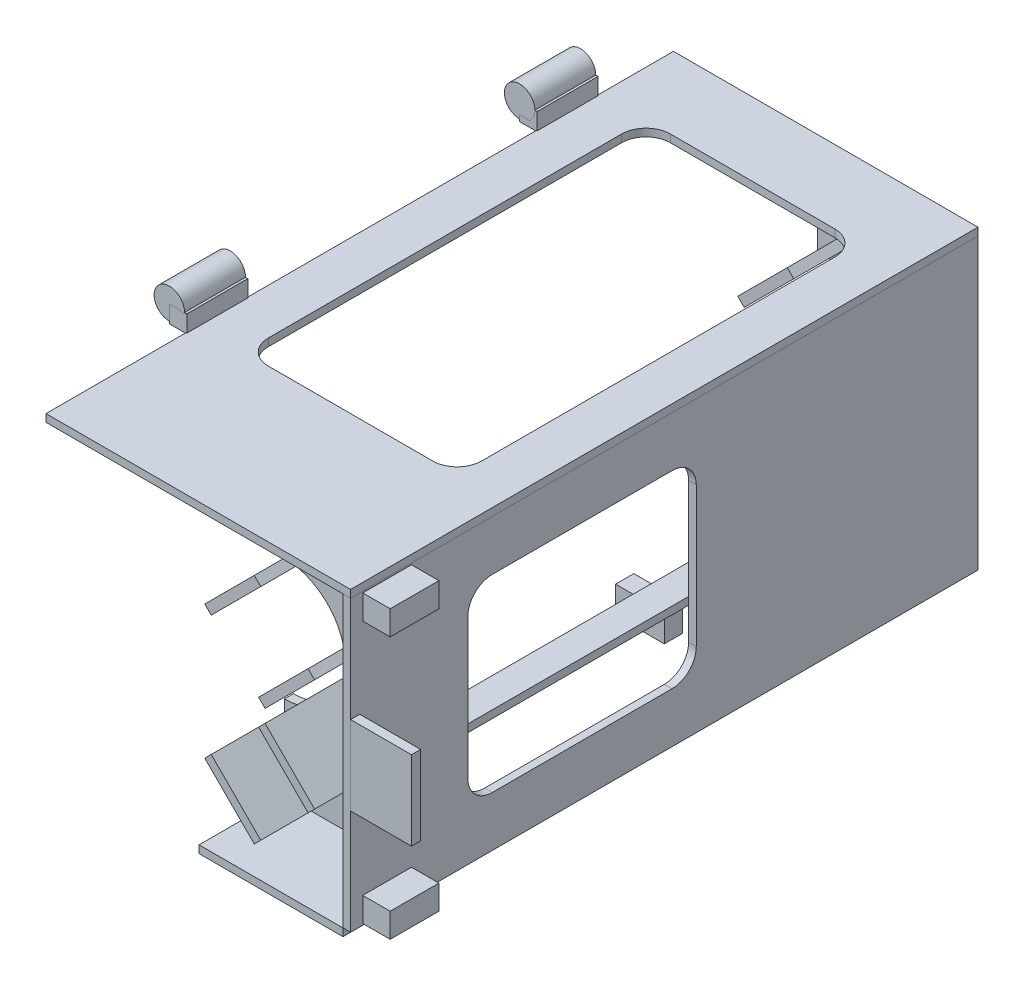
from build123d import *

# Parameters (mm, degrees)
EXTRUDE_START       = 180
EXTRUDE_1_DEPTH     = 6
EXTRUDE_START_2     = 186
EXTRUDE_2_DEPTH     = 56
EXTRUDE_3_DEPTH     = 56
EXTRUDE_4_DEPTH     = 56
EXTRUDE_5_DEPTH     = 56
EXTRUDE_START_3     = 530
EXTRUDE_6_DEPTH     = 6
EXTRUDE_START_4     = 536
EXTRUDE_7_DEPTH     = 56
EXTRUDE_8_DEPTH     = 56
EXTRUDE_9_DEPTH     = 56
EXTRUDE_10_DEPTH    = 56
EXTRUDE_START_5     = 95
EXTRUDE_SKETCH_11_W = 412
EXTRUDE_SKETCH_11_H = 190
EXTRUDE_11_DEPTH    = 5
EXTRUDE_SKETCH_12_W = 200
EXTRUDE_SKETCH_12_H = 412
EXTRUDE_12_DEPTH    = 5
EXTRUDE_START_6     = -100
EXTRUDE_SKETCH_13_W = 94.5
EXTRUDE_SKETCH_13_H = 412
EXTRUDE_13_DEPTH    = 5
EXTRUDE_START_7     = 230
EXTRUDE_SKETCH_14_R = 10
EXTRUDE_14_DEPTH    = 40
EXTRUDE_SKETCH_15_W = 11.5
EXTRUDE_SKETCH_15_H = 11.5
EXTRUDE_15_DEPTH    = 40
EXTRUDE_START_8     = 460
EXTRUDE_SKETCH_16_R = 10
EXTRUDE_16_DEPTH    = 40
EXTRUDE_SKETCH_17_W = 11.5
EXTRUDE_SKETCH_17_H = 11.5
EXTRUDE_17_DEPTH    = 40
EXTRUDE_START_9     = 290
EXTRUDE_SKETCH_18_W = 32
EXTRUDE_SKETCH_18_H = 18
EXTRUDE_18_DEPTH    = 12
EXTRUDE_START_10    = 450
EXTRUDE_SKETCH_19_W = 32
EXTRUDE_SKETCH_19_H = 18
EXTRUDE_19_DEPTH    = 12
EXTRUDE_START_11    = 586
EXTRUDE_SKETCH_20_W = 40
EXTRUDE_SKETCH_20_H = 52
EXTRUDE_20_DEPTH    = 6
EXTRUDE_START_12    = 552
EXTRUDE_SKETCH_21_W = 18
EXTRUDE_SKETCH_21_H = 16
EXTRUDE_21_DEPTH    = 32
EXTRUDE_SKETCH_22_W = 18
EXTRUDE_SKETCH_22_H = 16
EXTRUDE_22_DEPTH    = 32


with BuildPart() as part:
    # Extrude sketch 1 → Extrude 1 (new body)
    with BuildSketch(Plane.XY.offset(EXTRUDE_START)):
        with BuildLine():
            Line((95, -95), (95, 95))
            Line((95, 95), (0.5, 95))
            Line((0.5, 95), (0.5, 40))
            ThreePointArc((0.5, 40), (40.5, 0), (0.5, -40))
            Line((0.5, -40), (0.5, -95))
            Line((0.5, -95), (95, -95))
        make_face()
    extrude(amount=EXTRUDE_1_DEPTH)


with BuildPart() as body_2:
    # Extrude sketch 2 → Extrude 2 (new body)
    with BuildSketch(Plane.XY.offset(EXTRUDE_START_2)):
        Polygon((8.485281374, 39.597979746), (41.012193309, 72.124891681), (36.769552622, 76.367532368), (4.242640687, 43.840620434), align=None)
    extrude(amount=EXTRUDE_2_DEPTH)


with BuildPart() as body_3:
    # Extrude sketch 3 → Extrude 3 (new body)
    with BuildSketch(Plane.XY.offset(EXTRUDE_START_2)):
        Polygon((72.124891681, 41.012193309), (39.597979746, 8.485281374), (43.840620434, 4.242640687), (76.367532368, 36.769552622), align=None)
    extrude(amount=EXTRUDE_3_DEPTH)


with BuildPart() as body_4:
    # Extrude sketch 4 → Extrude 4 (new body)
    with BuildSketch(Plane.XY.offset(EXTRUDE_START_2)):
        Polygon((39.597979746, -8.485281374), (72.124891681, -41.012193309), (76.367532368, -36.769552622), (43.840620434, -4.242640687), align=None)
    extrude(amount=EXTRUDE_4_DEPTH)


with BuildPart() as body_5:
    # Extrude sketch 5 → Extrude 5 (new body)
    with BuildSketch(Plane.XY.offset(EXTRUDE_START_2)):
        Polygon((41.012193309, -72.124891681), (8.485281374, -39.597979746), (4.242640687, -43.840620434), (36.769552622, -76.367532368), align=None)
    extrude(amount=EXTRUDE_5_DEPTH)


with BuildPart() as body_6:
    # Extrude sketch 6 → Extrude 6 (new body)
    with BuildSketch(Plane.XY.offset(EXTRUDE_START_3)):
        with BuildLine():
            Line((95, -95), (95, 95))
            Line((95, 95), (0.5, 95))
            Line((0.5, 95), (0.5, 40))
            ThreePointArc((0.5, 40), (40.5, 0), (0.5, -40))
            Line((0.5, -40), (0.5, -95))
            Line((0.5, -95), (95, -95))
        make_face()
    extrude(amount=EXTRUDE_6_DEPTH)


with BuildPart() as body_7:
    # Extrude sketch 7 → Extrude 7 (new body)
    with BuildSketch(Plane.XY.offset(EXTRUDE_START_4)):
        Polygon((8.485281374, 39.597979746), (41.012193309, 72.124891681), (36.769552622, 76.367532368), (4.242640687, 43.840620434), align=None)
    extrude(amount=EXTRUDE_7_DEPTH)


with BuildPart() as body_8:
    # Extrude sketch 8 → Extrude 8 (new body)
    with BuildSketch(Plane.XY.offset(EXTRUDE_START_4)):
        Polygon((72.124891681, 41.012193309), (39.597979746, 8.485281374), (43.840620434, 4.242640687), (76.367532368, 36.769552622), align=None)
    extrude(amount=EXTRUDE_8_DEPTH)


with BuildPart() as body_9:
    # Extrude sketch 9 → Extrude 9 (new body)
    with BuildSketch(Plane.XY.offset(EXTRUDE_START_4)):
        Polygon((39.597979746, -8.485281374), (72.124891681, -41.012193309), (76.367532368, -36.769552622), (43.840620434, -4.242640687), align=None)
    extrude(amount=EXTRUDE_9_DEPTH)


with BuildPart() as body_10:
    # Extrude sketch 10 → Extrude 10 (new body)
    with BuildSketch(Plane.XY.offset(EXTRUDE_START_4)):
        Polygon((41.012193309, -72.124891681), (8.485281374, -39.597979746), (4.242640687, -43.840620434), (36.769552622, -76.367532368), align=None)
    extrude(amount=EXTRUDE_10_DEPTH)


with BuildPart() as body_11:
    # Extrude sketch 11 → Extrude 11 (new body)
    with BuildSketch(Plane(origin=(0, 0, 0), x_dir=(0, 0, -1), z_dir=(1, 0, 0)).offset(EXTRUDE_START_5)):
        with Locations((-386, 0)):
            Rectangle(EXTRUDE_SKETCH_11_W, EXTRUDE_SKETCH_11_H)
        with BuildLine():
            Line((-381, 62), (-499, 62))
            ThreePointArc((-499, 62), (-510.313708499, 57.313708499), (-515, 46))
            Line((-515, 46), (-515, -46))
            ThreePointArc((-515, -46), (-510.313708499, -57.313708499), (-499, -62))
            Line((-499, -62), (-381, -62))
            ThreePointArc((-381, -62), (-369.686291501, -57.313708499), (-365, -46))
            Line((-365, -46), (-365, 46))
            ThreePointArc((-365, 46), (-369.686291501, 57.313708499), (-381, 62))
        make_face(mode=Mode.SUBTRACT)
    extrude(amount=EXTRUDE_11_DEPTH)


with BuildPart() as body_12:
    # Extrude sketch 12 → Extrude 12 (new body)
    with BuildSketch(Plane(origin=(0, 0, 0), x_dir=(1, 0, 0), z_dir=(0, 1, 0)).offset(EXTRUDE_START_5)):
        with Locations((0, -386)):
            Rectangle(EXTRUDE_SKETCH_12_W, EXTRUDE_SKETCH_12_H)
        with BuildLine():
            Line((70, -244), (70, -476))
            ThreePointArc((70, -476), (65.313708499, -487.313708499), (54, -492))
            Line((54, -492), (-54, -492))
            ThreePointArc((-54, -492), (-65.313708499, -487.313708499), (-70, -476))
            Line((-70, -476), (-70, -244))
            ThreePointArc((-70, -244), (-65.313708499, -232.686291501), (-54, -228))
            Line((-54, -228), (54, -228))
            ThreePointArc((54, -228), (65.313708499, -232.686291501), (70, -244))
        make_face(mode=Mode.SUBTRACT)
    extrude(amount=EXTRUDE_12_DEPTH)


with BuildPart() as body_13:
    # Extrude sketch 13 → Extrude 13 (new body)
    with BuildSketch(Plane(origin=(0, 0, 0), x_dir=(1, 0, 0), z_dir=(0, 1, 0)).offset(EXTRUDE_START_6)):
        with Locations((47.75, -386)):
            Rectangle(EXTRUDE_SKETCH_13_W, EXTRUDE_SKETCH_13_H)
        with BuildLine():
            Line((76, -242), (76, -478))
            ThreePointArc((76, -478), (71.899494937, -487.899494937), (62, -492))
            Line((62, -492), (34, -492))
            ThreePointArc((34, -492), (24.100505063, -487.899494937), (20, -478))
            Line((20, -478), (20, -242))
            ThreePointArc((20, -242), (24.100505063, -232.100505063), (34, -228))
            Line((34, -228), (62, -228))
            ThreePointArc((62, -228), (71.899494937, -232.100505063), (76, -242))
        make_face(mode=Mode.SUBTRACT)
    extrude(amount=EXTRUDE_13_DEPTH)


with BuildPart() as body_14:
    # Extrude sketch 14 → Extrude 14 (new body)
    with BuildSketch(Plane.XY.offset(EXTRUDE_START_7)):
        with Locations((-111, 111)):
            Circle(EXTRUDE_SKETCH_14_R)
    extrude(amount=EXTRUDE_14_DEPTH)


with BuildPart() as body_15:
    # Extrude sketch 15 → Extrude 15 (new body)
    with BuildSketch(Plane.XY.offset(EXTRUDE_START_7)):
        with Locations((-105.25, 105.25)):
            Rectangle(EXTRUDE_SKETCH_15_W, EXTRUDE_SKETCH_15_H)
    extrude(amount=EXTRUDE_15_DEPTH)


with BuildPart() as body_16:
    # Extrude sketch 16 → Extrude 16 (new body)
    with BuildSketch(Plane.XY.offset(EXTRUDE_START_8)):
        with Locations((-111, 111)):
            Circle(EXTRUDE_SKETCH_16_R)
    extrude(amount=EXTRUDE_16_DEPTH)


with BuildPart() as body_17:
    # Extrude sketch 17 → Extrude 17 (new body)
    with BuildSketch(Plane.XY.offset(EXTRUDE_START_8)):
        with Locations((-105.25, 105.25)):
            Rectangle(EXTRUDE_SKETCH_17_W, EXTRUDE_SKETCH_17_H)
    extrude(amount=EXTRUDE_17_DEPTH)


with BuildPart() as body_18:
    # Extrude sketch 18 → Extrude 18 (new body)
    with BuildSketch(Plane.XY.offset(EXTRUDE_START_9)):
        with Locations((0, -109)):
            Rectangle(EXTRUDE_SKETCH_18_W, EXTRUDE_SKETCH_18_H)
    extrude(amount=EXTRUDE_18_DEPTH)


with BuildPart() as body_19:
    # Extrude sketch 19 → Extrude 19 (new body)
    with BuildSketch(Plane.XY.offset(EXTRUDE_START_10)):
        with Locations((0, -109)):
            Rectangle(EXTRUDE_SKETCH_19_W, EXTRUDE_SKETCH_19_H)
    extrude(amount=EXTRUDE_19_DEPTH)


with BuildPart() as body_20:
    # Extrude sketch 20 → Extrude 20 (new body)
    with BuildSketch(Plane.XY.offset(EXTRUDE_START_11)):
        with Locations((120, 0)):
            Rectangle(EXTRUDE_SKETCH_20_W, EXTRUDE_SKETCH_20_H)
    extrude(amount=EXTRUDE_20_DEPTH)


with BuildPart() as body_21:
    # Extrude sketch 21 → Extrude 21 (new body)
    with BuildSketch(Plane.XY.offset(EXTRUDE_START_12)):
        with Locations((109, 86)):
            Rectangle(EXTRUDE_SKETCH_21_W, EXTRUDE_SKETCH_21_H)
    extrude(amount=EXTRUDE_21_DEPTH)


with BuildPart() as body_22:
    # Extrude sketch 22 → Extrude 22 (new body)
    with BuildSketch(Plane.XY.offset(EXTRUDE_START_12)):
        with Locations((109, -86)):
            Rectangle(EXTRUDE_SKETCH_22_W, EXTRUDE_SKETCH_22_H)
    extrude(amount=EXTRUDE_22_DEPTH)


solid = Compound([part.part, body_2.part, body_3.part, body_4.part, body_5.part, body_6.part, body_7.part, body_8.part, body_9.part, body_10.part, body_11.part, body_12.part, body_13.part, body_14.part, body_15.part, body_16.part, body_17.part, body_18.part, body_19.part, body_20.part, body_21.part, body_22.part])
